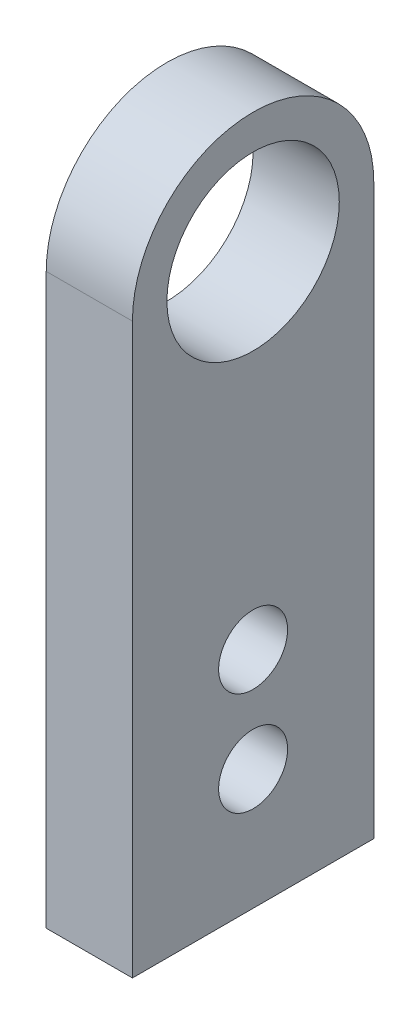
from build123d import *

# Parameters (mm, degrees)
SKETCH_1_R      = 5
SKETCH_1_R_2    = 2
EXTRUDE_1_DEPTH = 5


with BuildPart() as part:
    # 草图1 → 凸台-拉伸1 (new body)
    with BuildSketch(Plane(origin=(0, 0, 0), x_dir=(0, 0, -1), z_dir=(1, 0, 0))):
        with BuildLine():
            Line((-7, 33), (-7, 0))
            Line((-7, 0), (7, 0))
            Line((7, 0), (7, 33))
            ThreePointArc((7, 33), (0, 40), (-7, 33))
        make_face()
        with Locations((0, 33)):
            Circle(SKETCH_1_R, mode=Mode.SUBTRACT)
        with Locations((0, 13)):
            Circle(SKETCH_1_R_2, mode=Mode.SUBTRACT)
        with Locations((0, 7)):
            Circle(SKETCH_1_R_2, mode=Mode.SUBTRACT)
    extrude(amount=EXTRUDE_1_DEPTH)


solid = part.part
